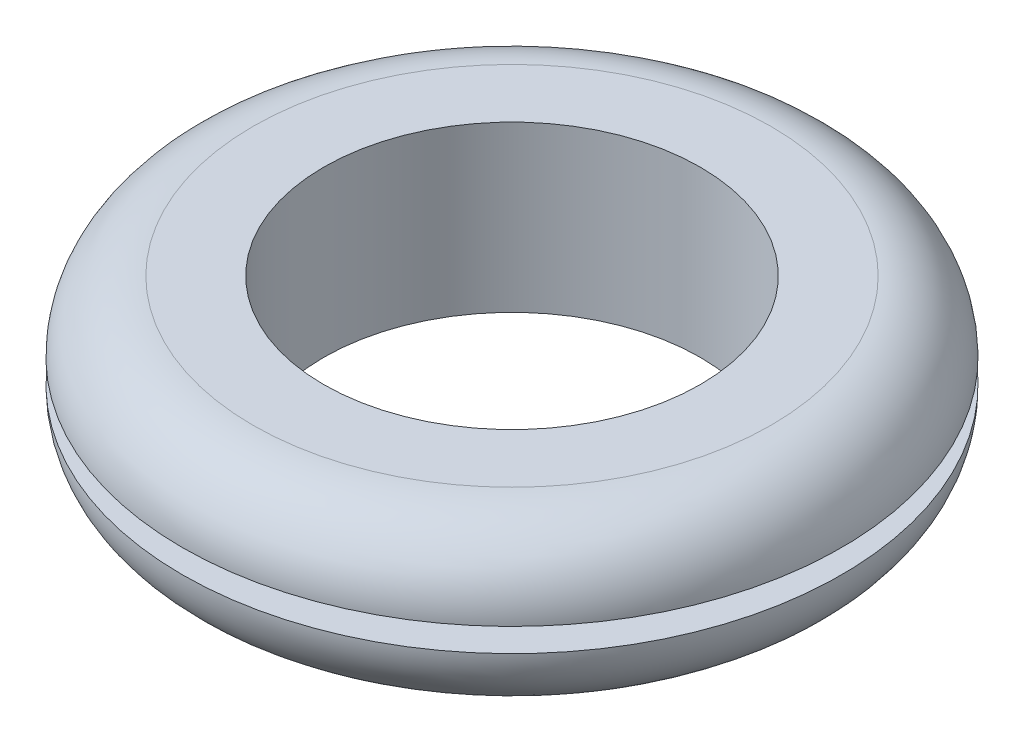
from build123d import *


with BuildPart() as part:
    # Sketch2 → Revolve1 (revolve)
    with BuildSketch(Plane.XY, mode=Mode.PRIVATE) as revolve1_sk:
        with BuildLine():
            Line((17.4625, 0.79375), (22.225, 0.79375))
            ThreePointArc((22.225, 0.79375), (20.830096045, 4.161346045), (17.4625, 5.55625))
            Line((17.4625, 5.55625), (12.7, 5.55625))
            Line((12.7, 5.55625), (12.7, -5.55625))
            Line((12.7, -5.55625), (17.4625, -5.55625))
            ThreePointArc((17.4625, -5.55625), (20.830096045, -4.161346045), (22.225, -0.79375))
            Line((22.225, -0.79375), (17.4625, -0.79375))
            Line((17.4625, -0.79375), (17.4625, 0.79375))
        make_face()
    revolve(revolve1_sk.sketch.rotate(Axis((0, 5.55625, 0), (0, -1, 0)), 90), axis=Axis((0, 5.55625, 0), (0, -1, 0)))


solid = part.part
